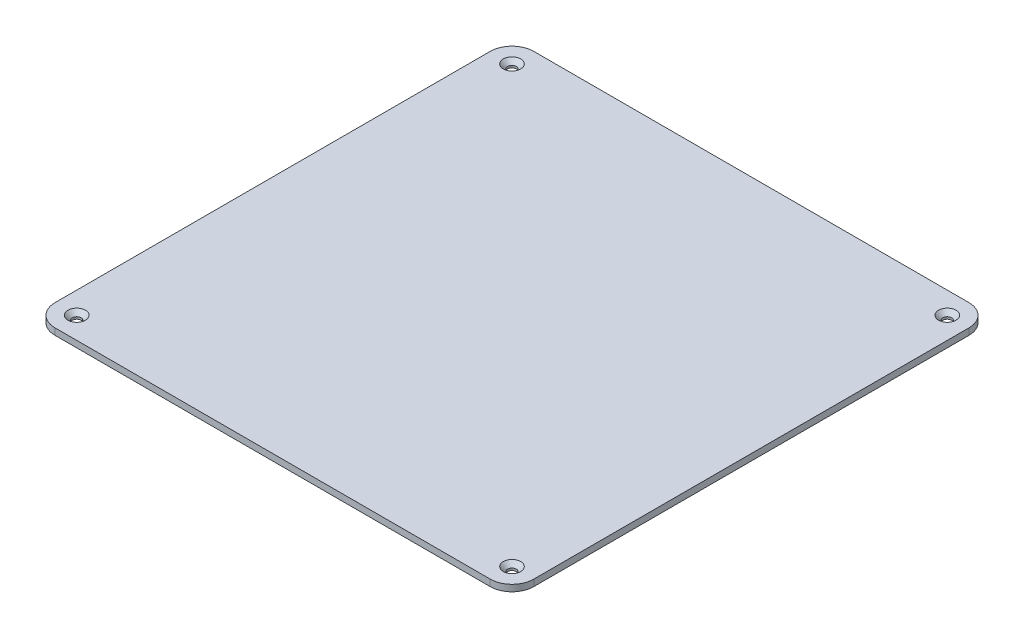
from build123d import *

# Parameters (mm, degrees)
SKETCH1_W           = 220
SKETCH1_H           = 220
BOSS_EXTRUDE1_DEPTH = 3
FILLET1_R           = 10
SKETCH2_R           = 2
CUT_EXTRUDE1_DEPTH  = 3
CHAMFER1_SIZE       = 2


with BuildPart() as part:
    # Sketch1 → Boss-Extrude1 (new body)
    with BuildSketch(Plane(origin=(0, 0, 0), x_dir=(1, 0, 0), z_dir=(0, 1, 0))):
        with Locations((-110, 110)):
            Rectangle(SKETCH1_W, SKETCH1_H)
    extrude(amount=BOSS_EXTRUDE1_DEPTH)

    # Fillet1
    fillet1_edges = [part.edges().sort_by_distance(p)[0] for p in [
        (0, 1.5, 0),
        (-220, 1.5, 0),
        (-220, 1.5, -220),
        (0, 1.5, -220),
    ]]
    fillet(fillet1_edges, radius=FILLET1_R)

    # Sketch2 → Cut-Extrude1 (cut)
    with BuildSketch(Plane(origin=(0, 3, 0), x_dir=(1, 0, 0), z_dir=(0, 1, 0))):
        with Locations(Location((-210, 210, 0), (0, 0, 270))):
            Circle(SKETCH2_R)
        with Locations(Location((-210, 10, 0), (0, 0, 270))):
            Circle(SKETCH2_R)
        with Locations(Location((-10, 10, 0), (0, 0, 90))):
            Circle(SKETCH2_R)
        with Locations(Location((-10, 210, 0), (0, 0, 90))):
            Circle(SKETCH2_R)
    extrude(amount=-CUT_EXTRUDE1_DEPTH, mode=Mode.SUBTRACT)

    # Chamfer1
    chamfer1_edges = [part.edges().sort_by_distance(p)[0] for p in [
        (-10, 3, -208),
        (-10, 3, -8),
        (-210, 3, -12),
        (-210, 3, -212),
    ]]
    chamfer(chamfer1_edges, length=CHAMFER1_SIZE)


solid = part.part
